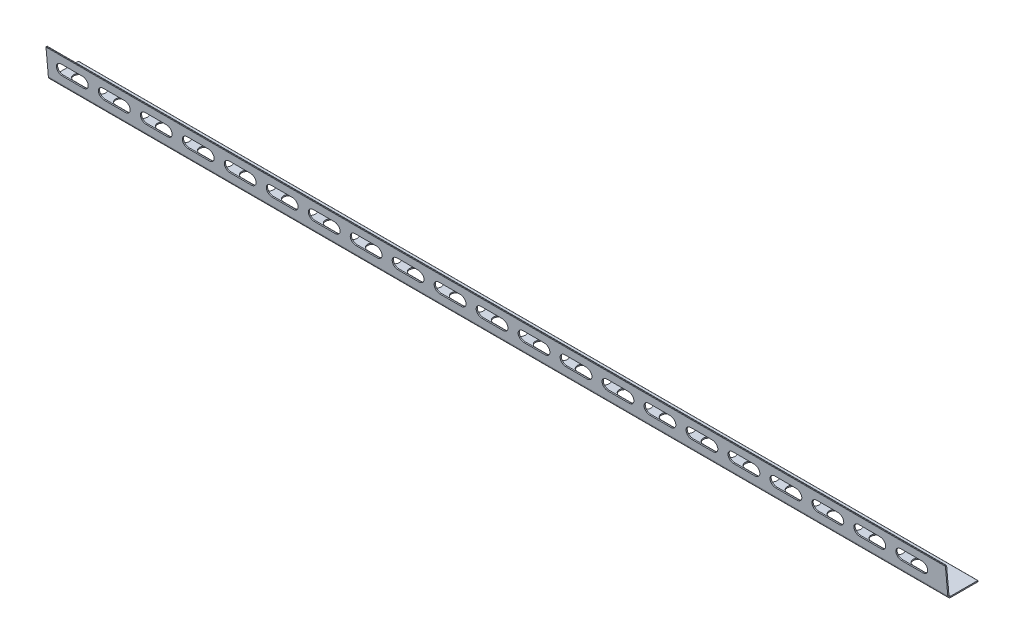
from build123d import *

# Parameters (mm, degrees)
EXTRUDE_1_DEPTH     = 1500
CUT_EXTRUDE_3_DEPTH = 1502.731074533
CUT_EXTRUDE_5_DEPTH = 1502.748551179


with BuildPart() as part:
    # 草图1 → 凸台-拉伸1 (new body)
    with BuildSketch(Plane(origin=(0, 0, 0), x_dir=(0, 0, -1), z_dir=(1, 0, 0))):
        with BuildLine():
            Line((-0.5, 0), (-45.41834413, 0))
            ThreePointArc((-45.41834413, 0), (-48.796295168, 1.313613316), (-50.39931762, 4.564221286))
            Line((-50.39931762, 4.564221286), (-54.314209266, 49.311637556))
            ThreePointArc((-54.314209266, 49.311637556), (-54.199134139, 49.676609232), (-53.859689788, 49.853312776))
            Line((-53.859689788, 49.853312776), (-52.86349509, 49.940468519))
            ThreePointArc((-52.86349509, 49.940468519), (-52.498523414, 49.825393391), (-52.32181987, 49.485949041))
            Line((-52.32181987, 49.485949041), (-48.406928224, 4.738532772))
            ThreePointArc((-48.406928224, 4.738532772), (-47.445114753, 2.78816799), (-45.41834413, 2))
            Line((-45.41834413, 2), (-0.5, 2))
            ThreePointArc((-0.5, 2), (-0.146446609, 1.853553391), (0, 1.5))
            Line((0, 1.5), (0, 0.5))
            ThreePointArc((0, 0.5), (-0.146446609, 0.146446609), (-0.5, 0))
        make_face()
    extrude(amount=EXTRUDE_1_DEPTH)

    # 草图3 → 切除-拉伸3 (cut, through all)
    with BuildSketch(Plane(origin=(0, -4.166892956, 47.627804429), x_dir=(-1, 0, 0), z_dir=(0, 0.08715574274765506, -0.9961946980917459))):
        with BuildLine():
            Line((-59.5, 40.939443007), (-24.5, 40.939443007))
            ThreePointArc((-24.5, 40.939443007), (-15.5, 31.939443007), (-24.5, 22.939443007))
            Line((-24.5, 22.939443007), (-59.5, 22.939443007))
            ThreePointArc((-59.5, 22.939443007), (-68.5, 31.939443007), (-59.5, 40.939443007))
        make_face()
        with BuildLine():
            Line((-129.5, 40.939443007), (-94.5, 40.939443007))
            ThreePointArc((-94.5, 40.939443007), (-85.5, 31.939443007), (-94.5, 22.939443007))
            Line((-94.5, 22.939443007), (-129.5, 22.939443007))
            ThreePointArc((-129.5, 22.939443007), (-138.5, 31.939443007), (-129.5, 40.939443007))
        make_face()
        with BuildLine():
            Line((-199.5, 40.939443007), (-164.5, 40.939443007))
            ThreePointArc((-164.5, 40.939443007), (-155.5, 31.939443007), (-164.5, 22.939443007))
            Line((-164.5, 22.939443007), (-199.5, 22.939443007))
            ThreePointArc((-199.5, 22.939443007), (-208.5, 31.939443007), (-199.5, 40.939443007))
        make_face()
        with BuildLine():
            Line((-269.5, 40.939443007), (-234.5, 40.939443007))
            ThreePointArc((-234.5, 40.939443007), (-225.5, 31.939443007), (-234.5, 22.939443007))
            Line((-234.5, 22.939443007), (-269.5, 22.939443007))
            ThreePointArc((-269.5, 22.939443007), (-278.5, 31.939443007), (-269.5, 40.939443007))
        make_face()
        with BuildLine():
            Line((-339.5, 40.939443007), (-304.5, 40.939443007))
            ThreePointArc((-304.5, 40.939443007), (-295.5, 31.939443007), (-304.5, 22.939443007))
            Line((-304.5, 22.939443007), (-339.5, 22.939443007))
            ThreePointArc((-339.5, 22.939443007), (-348.5, 31.939443007), (-339.5, 40.939443007))
        make_face()
        with BuildLine():
            Line((-409.5, 40.939443007), (-374.5, 40.939443007))
            ThreePointArc((-374.5, 40.939443007), (-365.5, 31.939443007), (-374.5, 22.939443007))
            Line((-374.5, 22.939443007), (-409.5, 22.939443007))
            ThreePointArc((-409.5, 22.939443007), (-418.5, 31.939443007), (-409.5, 40.939443007))
        make_face()
        with BuildLine():
            Line((-479.5, 40.939443007), (-444.5, 40.939443007))
            ThreePointArc((-444.5, 40.939443007), (-435.5, 31.939443007), (-444.5, 22.939443007))
            Line((-444.5, 22.939443007), (-479.5, 22.939443007))
            ThreePointArc((-479.5, 22.939443007), (-488.5, 31.939443007), (-479.5, 40.939443007))
        make_face()
        with BuildLine():
            Line((-549.5, 40.939443007), (-514.5, 40.939443007))
            ThreePointArc((-514.5, 40.939443007), (-505.5, 31.939443007), (-514.5, 22.939443007))
            Line((-514.5, 22.939443007), (-549.5, 22.939443007))
            ThreePointArc((-549.5, 22.939443007), (-558.5, 31.939443007), (-549.5, 40.939443007))
        make_face()
        with BuildLine():
            Line((-619.5, 40.939443007), (-584.5, 40.939443007))
            ThreePointArc((-584.5, 40.939443007), (-575.5, 31.939443007), (-584.5, 22.939443007))
            Line((-584.5, 22.939443007), (-619.5, 22.939443007))
            ThreePointArc((-619.5, 22.939443007), (-628.5, 31.939443007), (-619.5, 40.939443007))
        make_face()
        with BuildLine():
            Line((-689.5, 40.939443007), (-654.5, 40.939443007))
            ThreePointArc((-654.5, 40.939443007), (-645.5, 31.939443007), (-654.5, 22.939443007))
            Line((-654.5, 22.939443007), (-689.5, 22.939443007))
            ThreePointArc((-689.5, 22.939443007), (-698.5, 31.939443007), (-689.5, 40.939443007))
        make_face()
        with BuildLine():
            Line((-759.5, 40.939443007), (-724.5, 40.939443007))
            ThreePointArc((-724.5, 40.939443007), (-715.5, 31.939443007), (-724.5, 22.939443007))
            Line((-724.5, 22.939443007), (-759.5, 22.939443007))
            ThreePointArc((-759.5, 22.939443007), (-768.5, 31.939443007), (-759.5, 40.939443007))
        make_face()
        with BuildLine():
            Line((-829.5, 40.939443007), (-794.5, 40.939443007))
            ThreePointArc((-794.5, 40.939443007), (-785.5, 31.939443007), (-794.5, 22.939443007))
            Line((-794.5, 22.939443007), (-829.5, 22.939443007))
            ThreePointArc((-829.5, 22.939443007), (-838.5, 31.939443007), (-829.5, 40.939443007))
        make_face()
        with BuildLine():
            Line((-899.5, 40.939443007), (-864.5, 40.939443007))
            ThreePointArc((-864.5, 40.939443007), (-855.5, 31.939443007), (-864.5, 22.939443007))
            Line((-864.5, 22.939443007), (-899.5, 22.939443007))
            ThreePointArc((-899.5, 22.939443007), (-908.5, 31.939443007), (-899.5, 40.939443007))
        make_face()
        with BuildLine():
            Line((-969.5, 40.939443007), (-934.5, 40.939443007))
            ThreePointArc((-934.5, 40.939443007), (-925.5, 31.939443007), (-934.5, 22.939443007))
            Line((-934.5, 22.939443007), (-969.5, 22.939443007))
            ThreePointArc((-969.5, 22.939443007), (-978.5, 31.939443007), (-969.5, 40.939443007))
        make_face()
        with BuildLine():
            Line((-1039.5, 40.939443007), (-1004.5, 40.939443007))
            ThreePointArc((-1004.5, 40.939443007), (-995.5, 31.939443007), (-1004.5, 22.939443007))
            Line((-1004.5, 22.939443007), (-1039.5, 22.939443007))
            ThreePointArc((-1039.5, 22.939443007), (-1048.5, 31.939443007), (-1039.5, 40.939443007))
        make_face()
        with BuildLine():
            Line((-1109.5, 40.939443007), (-1074.5, 40.939443007))
            ThreePointArc((-1074.5, 40.939443007), (-1065.5, 31.939443007), (-1074.5, 22.939443007))
            Line((-1074.5, 22.939443007), (-1109.5, 22.939443007))
            ThreePointArc((-1109.5, 22.939443007), (-1118.5, 31.939443007), (-1109.5, 40.939443007))
        make_face()
        with BuildLine():
            Line((-1179.5, 40.939443007), (-1144.5, 40.939443007))
            ThreePointArc((-1144.5, 40.939443007), (-1135.5, 31.939443007), (-1144.5, 22.939443007))
            Line((-1144.5, 22.939443007), (-1179.5, 22.939443007))
            ThreePointArc((-1179.5, 22.939443007), (-1188.5, 31.939443007), (-1179.5, 40.939443007))
        make_face()
        with BuildLine():
            Line((-1249.5, 40.939443007), (-1214.5, 40.939443007))
            ThreePointArc((-1214.5, 40.939443007), (-1205.5, 31.939443007), (-1214.5, 22.939443007))
            Line((-1214.5, 22.939443007), (-1249.5, 22.939443007))
            ThreePointArc((-1249.5, 22.939443007), (-1258.5, 31.939443007), (-1249.5, 40.939443007))
        make_face()
        with BuildLine():
            Line((-1319.5, 40.939443007), (-1284.5, 40.939443007))
            ThreePointArc((-1284.5, 40.939443007), (-1275.5, 31.939443007), (-1284.5, 22.939443007))
            Line((-1284.5, 22.939443007), (-1319.5, 22.939443007))
            ThreePointArc((-1319.5, 22.939443007), (-1328.5, 31.939443007), (-1319.5, 40.939443007))
        make_face()
        with BuildLine():
            Line((-1389.5, 40.939443007), (-1354.5, 40.939443007))
            ThreePointArc((-1354.5, 40.939443007), (-1345.5, 31.939443007), (-1354.5, 22.939443007))
            Line((-1354.5, 22.939443007), (-1389.5, 22.939443007))
            ThreePointArc((-1389.5, 22.939443007), (-1398.5, 31.939443007), (-1389.5, 40.939443007))
        make_face()
        with BuildLine():
            Line((-1459.5, 40.939443007), (-1424.5, 40.939443007))
            ThreePointArc((-1424.5, 40.939443007), (-1415.5, 31.939443007), (-1424.5, 22.939443007))
            Line((-1424.5, 22.939443007), (-1459.5, 22.939443007))
            ThreePointArc((-1459.5, 22.939443007), (-1468.5, 31.939443007), (-1459.5, 40.939443007))
        make_face()
    extrude(amount=-CUT_EXTRUDE_3_DEPTH, mode=Mode.SUBTRACT)

    # 草图2 → 切除-拉伸5 (cut, through all)
    with BuildSketch(Plane(origin=(0, 2, 0), x_dir=(1, 0, 0), z_dir=(0, 1, 0))):
        with BuildLine():
            Line((24.5, -14.5), (59.5, -14.5))
            ThreePointArc((59.5, -14.5), (68.5, -23.5), (59.5, -32.5))
            Line((59.5, -32.5), (24.5, -32.5))
            ThreePointArc((24.5, -32.5), (15.5, -23.5), (24.5, -14.5))
        make_face()
        with BuildLine():
            Line((94.5, -14.5), (129.5, -14.5))
            ThreePointArc((129.5, -14.5), (138.5, -23.5), (129.5, -32.5))
            Line((129.5, -32.5), (94.5, -32.5))
            ThreePointArc((94.5, -32.5), (85.5, -23.5), (94.5, -14.5))
        make_face()
        with BuildLine():
            Line((164.5, -14.5), (199.5, -14.5))
            ThreePointArc((199.5, -14.5), (208.5, -23.5), (199.5, -32.5))
            Line((199.5, -32.5), (164.5, -32.5))
            ThreePointArc((164.5, -32.5), (155.5, -23.5), (164.5, -14.5))
        make_face()
        with BuildLine():
            Line((234.5, -14.5), (269.5, -14.5))
            ThreePointArc((269.5, -14.5), (278.5, -23.5), (269.5, -32.5))
            Line((269.5, -32.5), (234.5, -32.5))
            ThreePointArc((234.5, -32.5), (225.5, -23.5), (234.5, -14.5))
        make_face()
        with BuildLine():
            Line((304.5, -14.5), (339.5, -14.5))
            ThreePointArc((339.5, -14.5), (348.5, -23.5), (339.5, -32.5))
            Line((339.5, -32.5), (304.5, -32.5))
            ThreePointArc((304.5, -32.5), (295.5, -23.5), (304.5, -14.5))
        make_face()
        with BuildLine():
            Line((374.5, -14.5), (409.5, -14.5))
            ThreePointArc((409.5, -14.5), (418.5, -23.5), (409.5, -32.5))
            Line((409.5, -32.5), (374.5, -32.5))
            ThreePointArc((374.5, -32.5), (365.5, -23.5), (374.5, -14.5))
        make_face()
        with BuildLine():
            Line((444.5, -14.5), (479.5, -14.5))
            ThreePointArc((479.5, -14.5), (488.5, -23.5), (479.5, -32.5))
            Line((479.5, -32.5), (444.5, -32.5))
            ThreePointArc((444.5, -32.5), (435.5, -23.5), (444.5, -14.5))
        make_face()
        with BuildLine():
            Line((514.5, -14.5), (549.5, -14.5))
            ThreePointArc((549.5, -14.5), (558.5, -23.5), (549.5, -32.5))
            Line((549.5, -32.5), (514.5, -32.5))
            ThreePointArc((514.5, -32.5), (505.5, -23.5), (514.5, -14.5))
        make_face()
        with BuildLine():
            Line((584.5, -14.5), (619.5, -14.5))
            ThreePointArc((619.5, -14.5), (628.5, -23.5), (619.5, -32.5))
            Line((619.5, -32.5), (584.5, -32.5))
            ThreePointArc((584.5, -32.5), (575.5, -23.5), (584.5, -14.5))
        make_face()
        with BuildLine():
            Line((654.5, -14.5), (689.5, -14.5))
            ThreePointArc((689.5, -14.5), (698.5, -23.5), (689.5, -32.5))
            Line((689.5, -32.5), (654.5, -32.5))
            ThreePointArc((654.5, -32.5), (645.5, -23.5), (654.5, -14.5))
        make_face()
        with BuildLine():
            Line((724.5, -14.5), (759.5, -14.5))
            ThreePointArc((759.5, -14.5), (768.5, -23.5), (759.5, -32.5))
            Line((759.5, -32.5), (724.5, -32.5))
            ThreePointArc((724.5, -32.5), (715.5, -23.5), (724.5, -14.5))
        make_face()
        with BuildLine():
            Line((794.5, -14.5), (829.5, -14.5))
            ThreePointArc((829.5, -14.5), (838.5, -23.5), (829.5, -32.5))
            Line((829.5, -32.5), (794.5, -32.5))
            ThreePointArc((794.5, -32.5), (785.5, -23.5), (794.5, -14.5))
        make_face()
        with BuildLine():
            Line((864.5, -14.5), (899.5, -14.5))
            ThreePointArc((899.5, -14.5), (908.5, -23.5), (899.5, -32.5))
            Line((899.5, -32.5), (864.5, -32.5))
            ThreePointArc((864.5, -32.5), (855.5, -23.5), (864.5, -14.5))
        make_face()
        with BuildLine():
            Line((934.5, -14.5), (969.5, -14.5))
            ThreePointArc((969.5, -14.5), (978.5, -23.5), (969.5, -32.5))
            Line((969.5, -32.5), (934.5, -32.5))
            ThreePointArc((934.5, -32.5), (925.5, -23.5), (934.5, -14.5))
        make_face()
        with BuildLine():
            Line((1004.5, -14.5), (1039.5, -14.5))
            ThreePointArc((1039.5, -14.5), (1048.5, -23.5), (1039.5, -32.5))
            Line((1039.5, -32.5), (1004.5, -32.5))
            ThreePointArc((1004.5, -32.5), (995.5, -23.5), (1004.5, -14.5))
        make_face()
        with BuildLine():
            Line((1074.5, -14.5), (1109.5, -14.5))
            ThreePointArc((1109.5, -14.5), (1118.5, -23.5), (1109.5, -32.5))
            Line((1109.5, -32.5), (1074.5, -32.5))
            ThreePointArc((1074.5, -32.5), (1065.5, -23.5), (1074.5, -14.5))
        make_face()
        with BuildLine():
            Line((1144.5, -14.5), (1179.5, -14.5))
            ThreePointArc((1179.5, -14.5), (1188.5, -23.5), (1179.5, -32.5))
            Line((1179.5, -32.5), (1144.5, -32.5))
            ThreePointArc((1144.5, -32.5), (1135.5, -23.5), (1144.5, -14.5))
        make_face()
        with BuildLine():
            Line((1214.5, -14.5), (1249.5, -14.5))
            ThreePointArc((1249.5, -14.5), (1258.5, -23.5), (1249.5, -32.5))
            Line((1249.5, -32.5), (1214.5, -32.5))
            ThreePointArc((1214.5, -32.5), (1205.5, -23.5), (1214.5, -14.5))
        make_face()
        with BuildLine():
            Line((1284.5, -14.5), (1319.5, -14.5))
            ThreePointArc((1319.5, -14.5), (1328.5, -23.5), (1319.5, -32.5))
            Line((1319.5, -32.5), (1284.5, -32.5))
            ThreePointArc((1284.5, -32.5), (1275.5, -23.5), (1284.5, -14.5))
        make_face()
        with BuildLine():
            Line((1354.5, -14.5), (1389.5, -14.5))
            ThreePointArc((1389.5, -14.5), (1398.5, -23.5), (1389.5, -32.5))
            Line((1389.5, -32.5), (1354.5, -32.5))
            ThreePointArc((1354.5, -32.5), (1345.5, -23.5), (1354.5, -14.5))
        make_face()
        with BuildLine():
            Line((1424.5, -14.5), (1459.5, -14.5))
            ThreePointArc((1459.5, -14.5), (1468.5, -23.5), (1459.5, -32.5))
            Line((1459.5, -32.5), (1424.5, -32.5))
            ThreePointArc((1424.5, -32.5), (1415.5, -23.5), (1424.5, -14.5))
        make_face()
    extrude(amount=-CUT_EXTRUDE_5_DEPTH, mode=Mode.SUBTRACT)


solid = part.part
